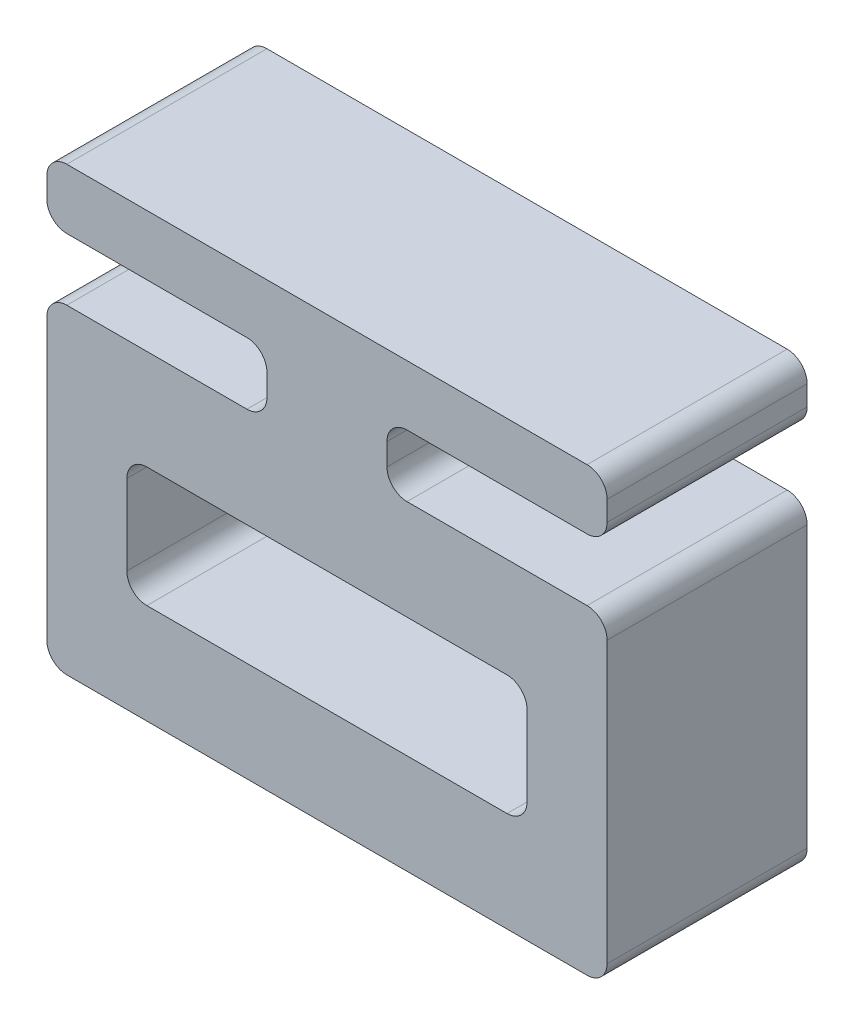
from build123d import *

# Parameters (mm, degrees)
SKETCH1_W           = 10
SKETCH1_H           = 3
BOSS_EXTRUDE1_DEPTH = 5
FILLET2_R           = 0.5


with BuildPart() as part:
    # Sketch1 → Boss-Extrude1 (new body)
    with BuildSketch(Plane.XY):
        Polygon((-7, -4), (7, -4), (7, 4), (1.5, 4), (1.5, 5.55), (7, 5.55), (7, 7.05), (-7, 7.05), (-7, 5.55), (-1.5, 5.55), (-1.5, 4), (-7, 4), align=None)
        Rectangle(SKETCH1_W, SKETCH1_H, mode=Mode.SUBTRACT)
    extrude(amount=BOSS_EXTRUDE1_DEPTH)

    # Fillet2
    fillet2_edges = [part.edges().sort_by_distance(p)[0] for p in [
        (-7, 4, 2.5),
        (-1.5, 4, 2.5),
        (-1.5, 5.55, 2.5),
        (-7, 5.55, 2.5),
        (-7, 7.05, 2.5),
        (7, 7.05, 2.5),
        (7, 5.55, 2.5),
        (1.5, 5.55, 2.5),
        (1.5, 4, 2.5),
        (7, 4, 2.5),
        (7, -4, 2.5),
        (-7, -4, 2.5),
        (-5, 1.5, 2.5),
        (-5, -1.5, 2.5),
        (5, -1.5, 2.5),
        (5, 1.5, 2.5),
    ]]
    fillet(fillet2_edges, radius=FILLET2_R)


solid = part.part
